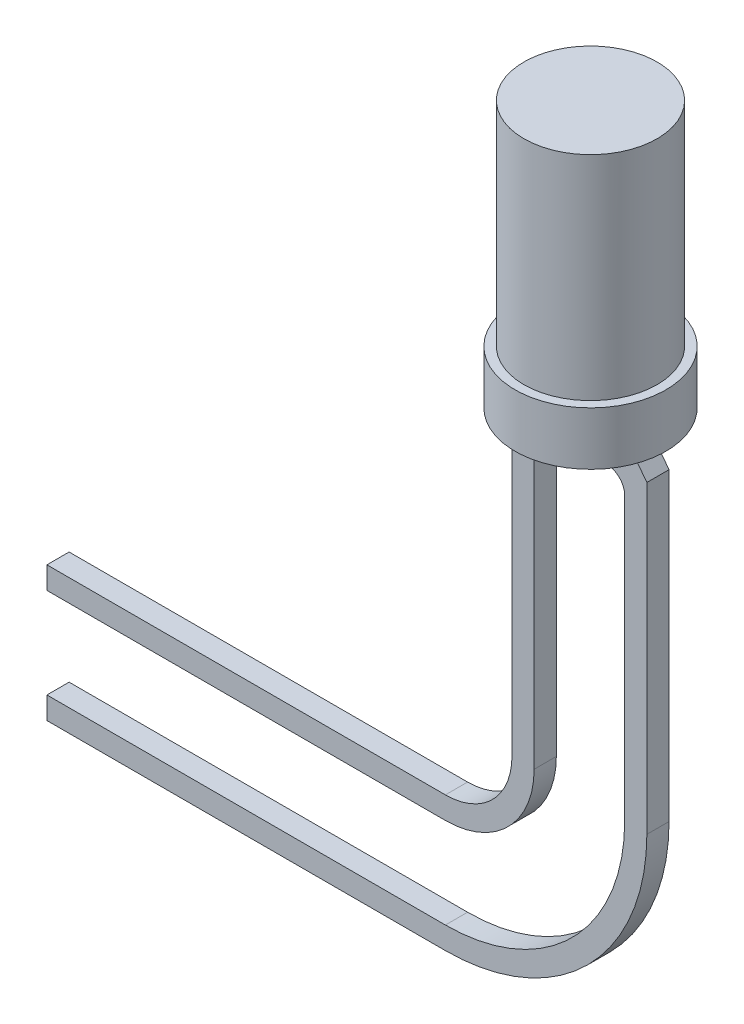
from build123d import *

# Parameters (mm, degrees)
ESQUISSE1_R             = 1.5
BOSS_EXTRU_1_DEPTH      = 4.8
ESQUISSE2_R             = 1.7
BOSS_EXTRU_2_DEPTH      = 1.2
BOSS_EXTRU_3_DEPTH      = 0.25
BOSS_EXTRU_3_DEPTH_BACK = 0.25


with BuildPart() as part:
    # Esquisse1 → Boss.-Extru.1 (new body)
    with BuildSketch(Plane(origin=(0, 0, 0), x_dir=(1, 0, 0), z_dir=(0, 1, 0))):
        Circle(ESQUISSE1_R)
    extrude(amount=-BOSS_EXTRU_1_DEPTH)

    # Esquisse2 → Boss.-Extru.2 (add)
    with BuildSketch(Plane.XZ.offset(4.8)):
        Circle(ESQUISSE2_R)
    extrude(amount=BOSS_EXTRU_2_DEPTH)

    # Esquisse3 → Boss.-Extru.3 (add, two sides: drawn at the far end of the back side and taken through both)
    with BuildSketch(Plane.XY.offset(-BOSS_EXTRU_3_DEPTH_BACK)):
        with BuildLine():
            Line((0.5, -6), (0.5, -6.672497838))
            Line((0.5, -6.672497838), (0.62, -6.672497838))
            ThreePointArc((0.62, -6.672497838), (0.902842712, -6.789655126), (1.02, -7.072497838))
            Line((1.02, -7.072497838), (1.02, -13.439637098))
            ThreePointArc((1.02, -13.439637098), (-0.163288604, -16.296348494), (-3.02, -17.479637098))
            Line((-3.02, -17.479637098), (-12, -17.479637098))
            Line((-12, -17.479637098), (-12, -17.979637098))
            Line((-12, -17.979637098), (-3.02, -17.979637098))
            ThreePointArc((-3.02, -17.979637098), (0.190264787, -16.649901885), (1.52, -13.439637098))
            Line((1.52, -13.439637098), (1.52, -6.572497838))
            Line((1.52, -6.572497838), (1.084066682, -6))
            Line((1.084066682, -6), (0.5, -6))
        make_face()
        with BuildLine():
            Line((-1.084066682, -6), (-0.5, -6))
            Line((-0.5, -6), (-0.5, -6.672497838))
            Line((-0.5, -6.672497838), (-0.62, -6.672497838))
            ThreePointArc((-0.62, -6.672497838), (-0.902842712, -6.789655126), (-1.02, -7.072497838))
            Line((-1.02, -7.072497838), (-1.02, -13.439637098))
            ThreePointArc((-1.02, -13.439637098), (-1.605786438, -14.85385066), (-3.02, -15.439637098))
            Line((-3.02, -15.439637098), (-12, -15.439637098))
            Line((-12, -15.439637098), (-12, -14.939637098))
            Line((-12, -14.939637098), (-3.02, -14.939637098))
            ThreePointArc((-3.02, -14.939637098), (-1.959339828, -14.50029727), (-1.52, -13.439637098))
            Line((-1.52, -13.439637098), (-1.52, -6.572497838))
            Line((-1.52, -6.572497838), (-1.084066682, -6))
        make_face()
    extrude(amount=BOSS_EXTRU_3_DEPTH + BOSS_EXTRU_3_DEPTH_BACK)


solid = part.part
